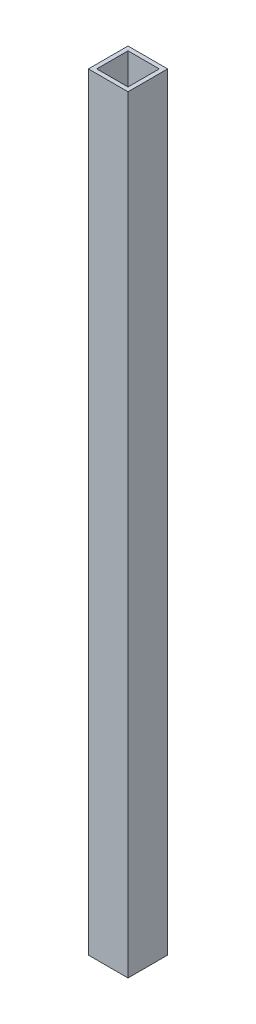
from build123d import *

# Parameters (mm, degrees)
SKETCH1_W           = 19
SKETCH1_H           = 19
SKETCH1_W_2         = 15
SKETCH1_H_2         = 15
EXTRUDE_THIN1_DEPTH = 368


with BuildPart() as part:
    # Sketch1 → Extrude-Thin1 (new body)
    with BuildSketch(Plane(origin=(0, 0, 0), x_dir=(1, 0, 0), z_dir=(0, 1, 0))):
        Rectangle(SKETCH1_W, SKETCH1_H)
        Rectangle(SKETCH1_W_2, SKETCH1_H_2, mode=Mode.SUBTRACT)
    extrude(amount=EXTRUDE_THIN1_DEPTH)


solid = part.part
